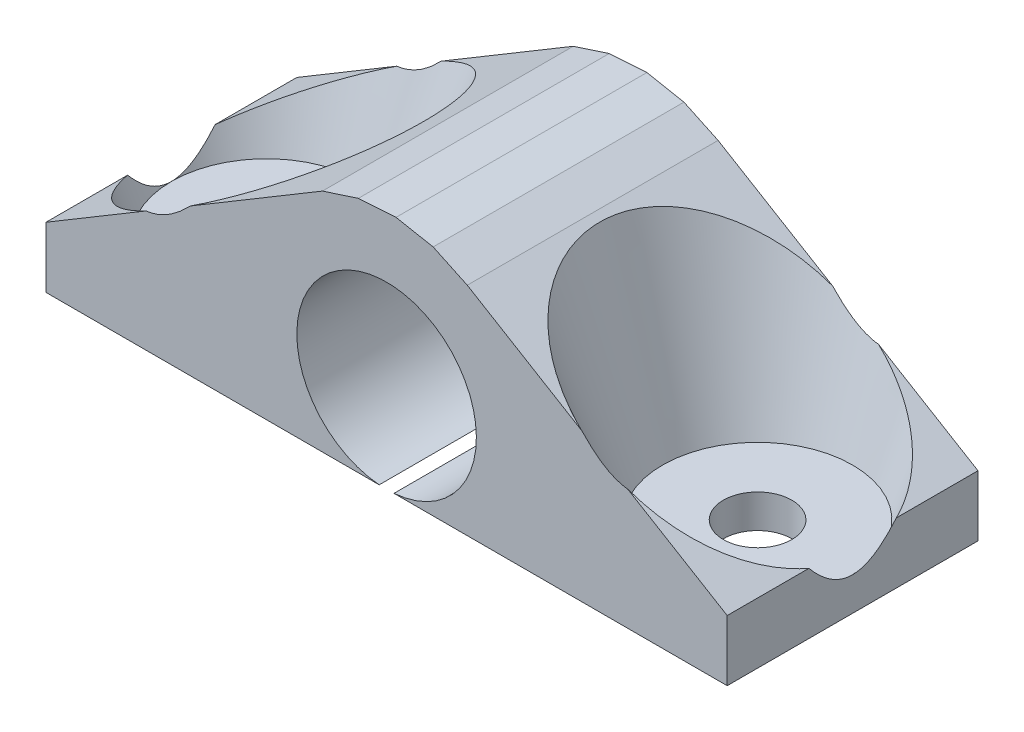
from build123d import *

# Parameters (mm, degrees)
BOSS_EXTRUDE1_DEPTH   = 16.5
M10_CLEARANCE_HOLE1_D = 11.8125


with BuildPart() as part:
    # Sketch1 → Boss-Extrude1 (new body)
    with BuildSketch(Plane.XY.offset(8.25)):
        Polygon((22.406299796, -1.906250123), (5.308030128, 8.36411953), (3.061199903, 9.42140007), (0.622018993, 9.886699677), (-1.856250048, 9.730779648), (-4.217879772, 8.963439941), (-22.406200409, -1.90625), (-22.406200409, -5.90625), (22.406299796, -5.90625), align=None)
    extrude(amount=-BOSS_EXTRUDE1_DEPTH)

    # Sketch2 → Cut-Revolve1 (revolve, cut)
    with BuildSketch(Plane.XY, mode=Mode.PRIVATE) as cut_revolve1_sk:
        Polygon((26.531393942, 8.080018406), (16.1562, 8.080018406), (16.1562, -5.90625), (18.4062, -5.90625), (18.4062, -3.70625), (22.4062, -3.70625), align=None)
    revolve(cut_revolve1_sk.sketch.rotate(Axis((16.1562, 8.080018406, 0), (0, -1, 0)), 92.019039349), axis=Axis((16.1562, 8.080018406, 0), (0, -1, 0)), mode=Mode.SUBTRACT)

    # Sketch3 → Cut-Revolve2 (revolve, cut)
    with BuildSketch(Plane(origin=(0, 0, 0), x_dir=(-1, 0, 0), z_dir=(0, 0, -1)), mode=Mode.PRIVATE) as cut_revolve2_sk:
        Polygon((13.9062, -5.90625), (16.1562, -5.90625), (16.1562, 8.015867372), (5.80345892, 8.015867372), (9.9062, -3.70625), (13.9062, -3.70625), align=None)
    revolve(cut_revolve2_sk.sketch.rotate(Axis((-16.1562, -5.90625, 0), (0, 1, 0)), 270), axis=Axis((-16.1562, -5.90625, 0), (0, 1, 0)), mode=Mode.SUBTRACT)

    # M10 Clearance Hole1 (through all)
    with Locations(Plane.XY.offset(8.25)):
        with Locations((0, -0.02)):
            Hole(M10_CLEARANCE_HOLE1_D / 2)


solid = part.part
